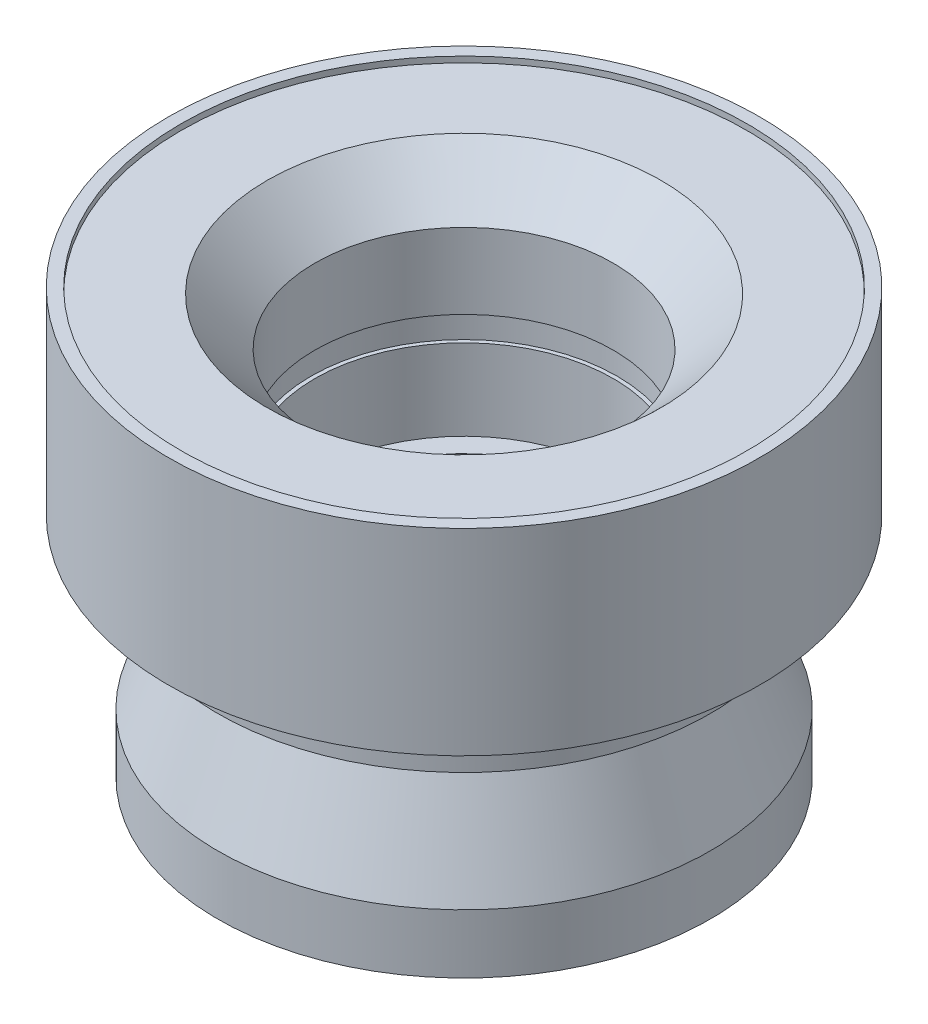
from build123d import *


with BuildPart() as part:
    # Sketch1 → Revolve1 (revolve)
    with BuildSketch(Plane.XY, mode=Mode.PRIVATE) as revolve1_sk:
        Polygon((38.1, 19.812), (38.1, -5.588), (31.75, -5.588), (31.75, -11.938), (26.168529842, -11.938), (31.75, -27.272963227), (31.75, -34.892963227), (25.4, -34.892963227), (16.4973, -10.432996005), (19.2405, -10.432996005), (19.2405, 0), (19.7485, 0), (19.7485, 3.175), (19.2405, 3.175), (19.2405, 12.8905), (25.4, 19.05), (36.5125, 19.05), (36.5125, 19.812), align=None)
    revolve(revolve1_sk.sketch.rotate(Axis((0, 41.940040976, 0), (0, -1, 0)), 180), axis=Axis((0, 41.940040976, 0), (0, -1, 0)))


solid = part.part
